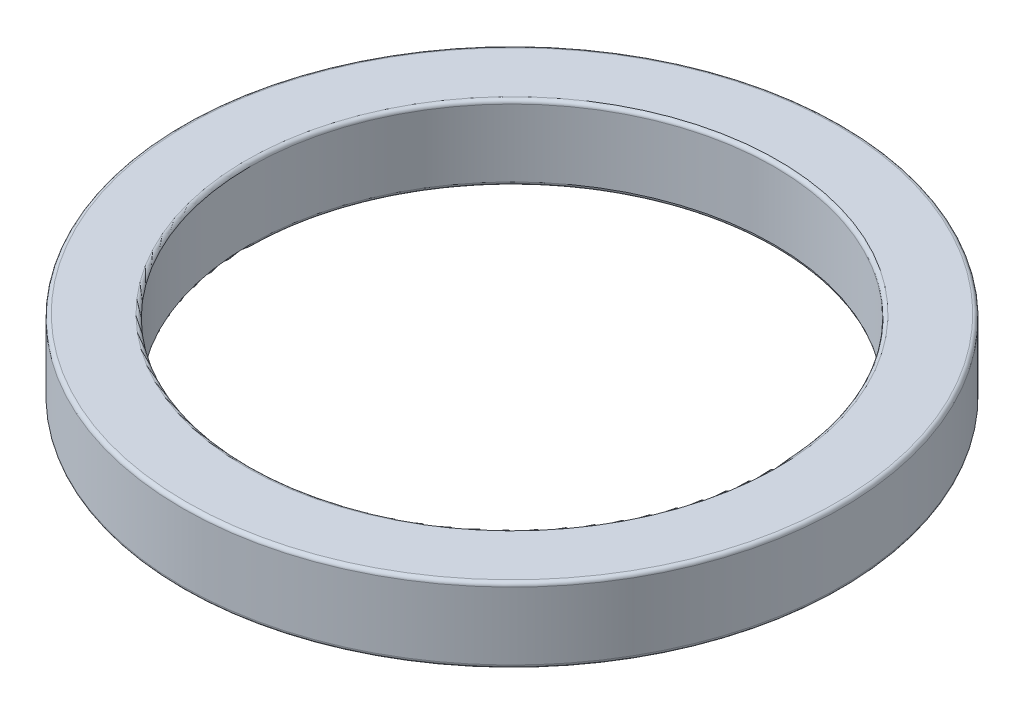
from build123d import *

# Parameters (mm, degrees)
SKETCH_1_R      = 22
SKETCH_1_R_2    = 17.5
EXTRUDE_1_DEPTH = 5
FILLET_1_R      = 0.25


with BuildPart() as part:
    # 草图1 → 凸台-拉伸1 (new body)
    with BuildSketch(Plane(origin=(0, 0, 0), x_dir=(1, 0, 0), z_dir=(0, 1, 0))):
        with Locations(Location((0, 0, 0), (0, 0, 270))):
            Circle(SKETCH_1_R)
        with Locations(Location((0, 0, 0), (0, 0, 270))):
            Circle(SKETCH_1_R_2, mode=Mode.SUBTRACT)
    extrude(amount=EXTRUDE_1_DEPTH)

    # 圆角1
    fillet_1_edges = [part.edges().sort_by_distance(p)[0] for p in [
        (0, 0, -22),
        (0, 5, -22),
        (0, 0, -17.5),
        (0, 5, -17.5),
    ]]
    fillet(fillet_1_edges, radius=FILLET_1_R)


solid = part.part
